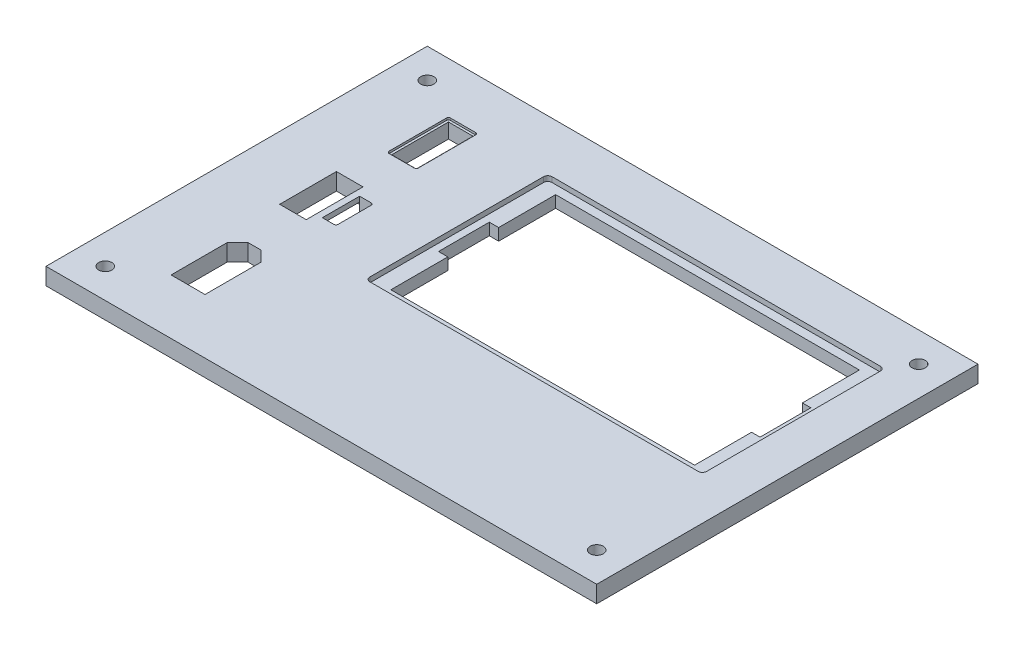
from build123d import *

# Parameters (mm, degrees)
SKETCH_1_W             = 130
SKETCH_1_H             = 90
SKETCH_1_W_2           = 71.7
SKETCH_1_H_2           = 38.9
EXTRUDE_399_DEPTH      = 4
CUT_EXTRUDE_706_DEPTH  = 1.2
SKETCH_3_W             = 5.8
SKETCH_3_H             = 13.4
USB_DEPTH              = 80.158069709
SKETCH_4_W             = 4.4
SKETCH_4_H             = 12
CUT_EXTRUDE_1602_DEPTH = 80.106510478
USB_2_DEPTH            = 0.5
SKETCH_8_W             = 1.5
SKETCH_8_H             = 18.480447519
USB_3_DEPTH            = 1.2
XT60_DEPTH             = 80.158069709
SKETCH_9_R             = 1.55
CUT_EXTRUDE_6_DEPTH    = 80.158069709


with BuildPart() as part:
    # Эскиз1 → Extrude 399 (new body)
    with BuildSketch(Plane(origin=(0, 0, 0), x_dir=(1, 0, 0), z_dir=(0, 1, 0))):
        Rectangle(SKETCH_1_W, SKETCH_1_H)
        with Locations((15.15, 11.55)):
            Rectangle(SKETCH_1_W_2, SKETCH_1_H_2, mode=Mode.SUBTRACT)
    extrude(amount=EXTRUDE_399_DEPTH)

    # Эскиз2 → Cut-Extrude 706 (cut)
    with BuildSketch(Plane(origin=(0, 4, 0), x_dir=(1, 0, 0), z_dir=(0, 1, 0))):
        with BuildLine():
            Line((-23.6, 33.05), (53.9, 33.05))
            ThreePointArc((53.9, 33.05), (54.607106781, 32.757106781), (54.9, 32.05))
            Line((54.9, 32.05), (54.9, -8.95))
            ThreePointArc((54.9, -8.95), (54.607106781, -9.657106781), (53.9, -9.95))
            Line((53.9, -9.95), (-23.6, -9.95))
            ThreePointArc((-23.6, -9.95), (-24.307106781, -9.657106781), (-24.6, -8.95))
            Line((-24.6, -8.95), (-24.6, 32.05))
            ThreePointArc((-24.6, 32.05), (-24.307106781, 32.757106781), (-23.6, 33.05))
        make_face()
    extrude(amount=-CUT_EXTRUDE_706_DEPTH, mode=Mode.SUBTRACT)

    # Эскиз3 → USB (cut, through all)
    with BuildSketch(Plane(origin=(0, 4, 0), x_dir=(1, 0, 0), z_dir=(0, 1, 0))):
        with BuildLine():
            Line((-50.1, -4.75), (-50.1, 8.65))
            Line((-50.1, 8.65), (-43.7, 8.65))
            Line((-43.7, 8.65), (-43.7, 11.1))
            Line((-43.7, 11.1), (-42.4, 11.1))
            Line((-42.4, 11.1), (-42.4, 6.35))
            Line((-42.4, 6.35), (-39.6, 6.35))
            ThreePointArc((-39.6, 6.35), (-39.246446609, 6.203553391), (-39.1, 5.85))
            Line((-39.1, 5.85), (-39.1, -1.95))
            ThreePointArc((-39.1, -1.95), (-39.246446609, -2.303553391), (-39.6, -2.45))
            Line((-39.6, -2.45), (-42.5, -2.45))
            Line((-42.5, -2.45), (-42.5, -7.2))
            Line((-42.5, -7.2), (-43.8, -7.2))
            Line((-43.8, -7.2), (-43.8, -4.75))
            Line((-43.8, -4.75), (-50.1, -4.75))
        make_face()
        with Locations((-44.6, 25.8)):
            Rectangle(SKETCH_3_W, SKETCH_3_H)
    extrude(amount=-USB_DEPTH, mode=Mode.SUBTRACT)

    # Эскиз4 → Cut-Extrude 1602 (cut, through all)
    with BuildSketch(Plane(origin=(0, 2.8, 0), x_dir=(1, 0, 0), z_dir=(0, 1, 0))):
        with Locations((-20.7, 11.55)):
            Rectangle(SKETCH_4_W, SKETCH_4_H)
        with Locations((50.8, 11.55)):
            Rectangle(SKETCH_4_W, SKETCH_4_H)
    extrude(amount=-CUT_EXTRUDE_1602_DEPTH, mode=Mode.SUBTRACT)

    # Эскиз7 → USB 2 (cut)
    with BuildSketch(Plane(origin=(0, 4, 0), x_dir=(1, 0, 0), z_dir=(0, 1, 0))):
        with BuildLine():
            Line((-47.55, 33.05), (-41.65, 33.05))
            ThreePointArc((-41.65, 33.05), (-41.296446609, 32.903553391), (-41.15, 32.55))
            Line((-41.15, 32.55), (-41.15, 19.05))
            ThreePointArc((-41.15, 19.05), (-41.296446609, 18.696446609), (-41.65, 18.55))
            Line((-41.65, 18.55), (-47.55, 18.55))
            ThreePointArc((-47.55, 18.55), (-47.903553391, 18.696446609), (-48.05, 19.05))
            Line((-48.05, 19.05), (-48.05, 32.55))
            ThreePointArc((-48.05, 32.55), (-47.903553391, 32.903553391), (-47.55, 33.05))
        make_face()
    extrude(amount=-USB_2_DEPTH, mode=Mode.SUBTRACT)

    # Эскиз8 → USB 3 (add)
    with BuildSketch(Plane(origin=(0, 4, 0), x_dir=(1, 0, 0), z_dir=(0, 1, 0))):
        with Locations((-43.069744148, 1.932070249)):
            Rectangle(SKETCH_8_W, SKETCH_8_H)
    extrude(amount=-USB_3_DEPTH)

    # Эскиз5 → XT60 (cut, through all)
    with BuildSketch(Plane(origin=(0, 4, 0), x_dir=(1, 0, 0), z_dir=(0, 1, 0))):
        Polygon((-48.468705951, -32), (-40.468705951, -32), (-40.468705951, -18.8), (-42.951848706, -16.3), (-45.985563195, -16.3), (-48.468705951, -18.8), align=None)
    extrude(amount=-XT60_DEPTH, mode=Mode.SUBTRACT)

    # Эскиз9 → Вырез-Вытянуть6 (cut, through all)
    with BuildSketch(Plane(origin=(0, 4, 0), x_dir=(1, 0, 0), z_dir=(0, 1, 0))):
        with Locations(Location((-58, 38, 0), (0, 0, 270))):
            Circle(SKETCH_9_R)
        with Locations(Location((58, 38, 0), (0, 0, 270))):
            Circle(SKETCH_9_R)
        with Locations(Location((-58, -38, 0), (0, 0, 270))):
            Circle(SKETCH_9_R)
        with Locations(Location((58, -38, 0), (0, 0, 270))):
            Circle(SKETCH_9_R)
    extrude(amount=-CUT_EXTRUDE_6_DEPTH, mode=Mode.SUBTRACT)


solid = part.part
